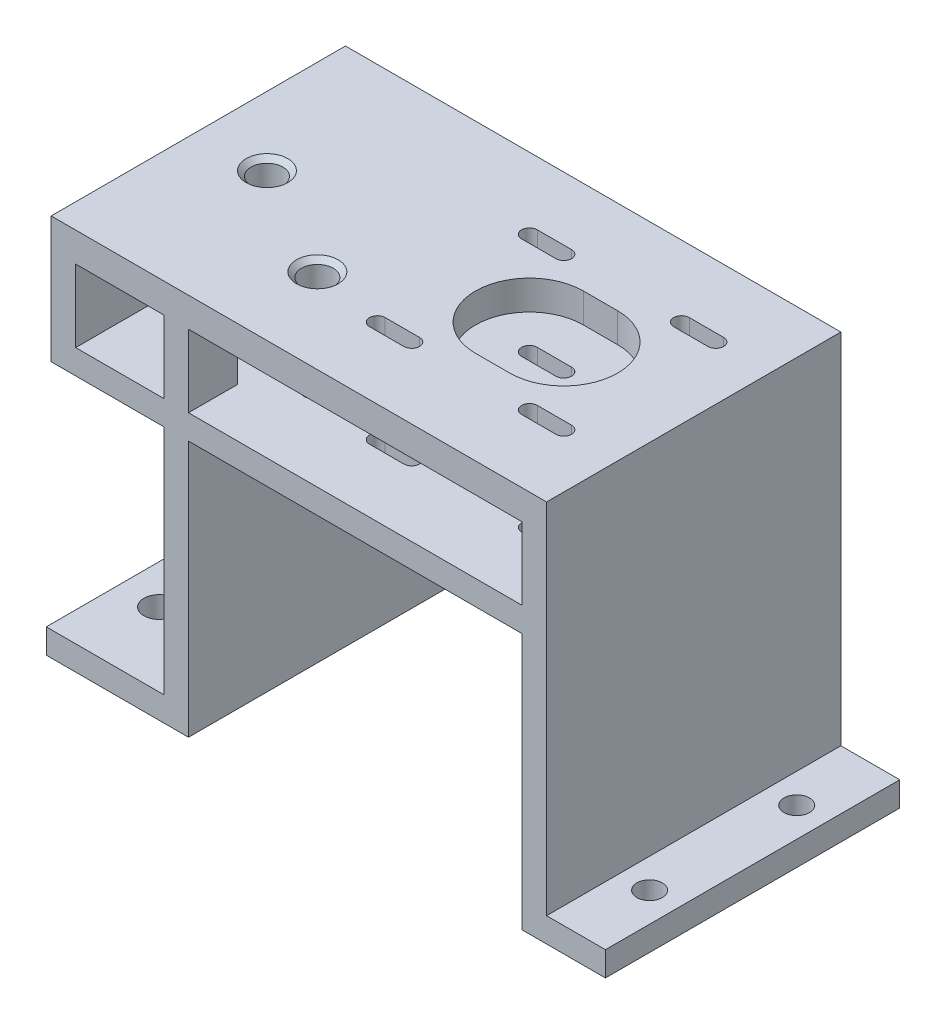
from build123d import *

# Parameters (mm, degrees)
SKETCH1_W           = 68
SKETCH1_H           = 14.75
SKETCH1_W_2         = 18
BOSS_EXTRUDE1_DEPTH = 60
CUT_EXTRUDE1_REACH  = 132.065
SKETCH2_W           = 40
SKETCH2_H           = 14.75
CUT_EXTRUDE2_DEPTH  = 131.064608945
CUT_EXTRUDE3_REACH  = 132.065
SKETCH5_R           = 3.25
CUT_EXTRUDE4_REACH  = 120.778
SKETCH6_R           = 2.6
SKETCH7_R           = 2.6
CUT_EXTRUDE5_DEPTH  = 131.064608945
CUT_EXTRUDE6_REACH  = 132.065
SKETCH8_R           = 3.25
CHAMFER1_SIZE       = 1
CUT_EXTRUDE8_REACH  = 132.065
SKETCH10_R          = 3.1
SKETCH10_R_2        = 2.6
SKETCH11_W          = 18.5
SKETCH11_H          = 16
BOSS_EXTRUDE2_DEPTH = 12
SKETCH12_R          = 3.25
CUT_EXTRUDE9_DEPTH  = 119.802577834
CHAMFER2_SIZE       = 1


with BuildPart() as part:
    # Sketch1 → Boss-Extrude1 (new body)
    with BuildSketch(Plane.XY):
        Polygon((0, 0), (-29, 0), (-29, 5), (-5, 5), (-5, 52.3), (-28, 52.3), (-28, 78.05), (73, 78.05), (73, 5), (85, 5), (85, 0), (68, 0), (68, 52.3), (0, 52.3), align=None)
        with Locations((34, 64.675)):
            Rectangle(SKETCH1_W, SKETCH1_H, mode=Mode.SUBTRACT)
        with Locations((-14, 64.675)):
            Rectangle(SKETCH1_W_2, SKETCH1_H, mode=Mode.SUBTRACT)
    extrude(amount=BOSS_EXTRUDE1_DEPTH)

    # Sketch2 → Cut-Extrude1 (cut, up to next)
    with BuildSketch(Plane(origin=(0, 0, 0), x_dir=(0, 0, -1), z_dir=(1, 0, 0)), mode=Mode.PRIVATE) as cut_extrude1_sk1:
        with Locations((-30, 64.675)):
            Rectangle(SKETCH2_W, SKETCH2_H)
    cut_extrude1_tool1 = extrude(cut_extrude1_sk1.sketch, amount=-CUT_EXTRUDE1_REACH, mode=Mode.PRIVATE) & part.part
    add(cut_extrude1_tool1.solids().sort_by_distance((0, 64.675, 30))[0], mode=Mode.SUBTRACT)

    # Sketch3 → Cut-Extrude2 (cut, through all)
    with BuildSketch(Plane(origin=(0, 78.05, 0), x_dir=(1, 0, 0), z_dir=(0, 1, 0))):
        with BuildLine():
            Line((39.5, -19), (46.5, -19))
            ThreePointArc((46.5, -19), (57.5, -30), (46.5, -41))
            Line((46.5, -41), (39.5, -41))
            ThreePointArc((39.5, -41), (28.5, -30), (39.5, -19))
        make_face()
        with BuildLine():
            Line((31, -16.1), (24, -16.1))
            ThreePointArc((24, -16.1), (22.4, -14.5), (24, -12.9))
            Line((24, -12.9), (31, -12.9))
            ThreePointArc((31, -12.9), (32.6, -14.5), (31, -16.1))
        make_face()
        with BuildLine():
            Line((55, -16.1), (62, -16.1))
            ThreePointArc((62, -16.1), (63.6, -14.5), (62, -12.9))
            Line((62, -12.9), (55, -12.9))
            ThreePointArc((55, -12.9), (53.4, -14.5), (55, -16.1))
        make_face()
        with BuildLine():
            Line((31, -43.9), (24, -43.9))
            ThreePointArc((24, -43.9), (22.4, -45.5), (24, -47.1))
            Line((24, -47.1), (31, -47.1))
            ThreePointArc((31, -47.1), (32.6, -45.5), (31, -43.9))
        make_face()
        with BuildLine():
            Line((55, -43.9), (62, -43.9))
            ThreePointArc((62, -43.9), (63.6, -45.5), (62, -47.1))
            Line((62, -47.1), (55, -47.1))
            ThreePointArc((55, -47.1), (53.4, -45.5), (55, -43.9))
        make_face()
    extrude(amount=-CUT_EXTRUDE2_DEPTH, mode=Mode.SUBTRACT)

    # Sketch5 → Cut-Extrude3 (cut, up to next)
    with BuildSketch(Plane(origin=(0, 78.05, 0), x_dir=(1, 0, 0), z_dir=(0, 1, 0)), mode=Mode.PRIVATE) as cut_extrude3_sk1:
        with Locations(Location((9, -42.73, 0), (0, 0, 270))):
            Circle(SKETCH5_R)
    cut_extrude3_tool1 = extrude(cut_extrude3_sk1.sketch, amount=-CUT_EXTRUDE3_REACH, mode=Mode.PRIVATE) & part.part
    add(cut_extrude3_tool1.solids().sort_by_distance((9, 78.05, 42.73))[0], mode=Mode.SUBTRACT)

    # Sketch6 → Cut-Extrude4 (cut, up to next)
    with BuildSketch(Plane(origin=(0, 57.3, 0), x_dir=(1, 0, 0), z_dir=(0, 1, 0)), mode=Mode.PRIVATE) as cut_extrude4_sk1:
        with Locations(Location((9, -42.73, 0), (0, 0, 270))):
            Circle(SKETCH6_R)
    cut_extrude4_tool1 = extrude(cut_extrude4_sk1.sketch, amount=-CUT_EXTRUDE4_REACH, mode=Mode.PRIVATE) & part.part
    add(cut_extrude4_tool1.solids().sort_by_distance((9, 57.3, 42.73))[0], mode=Mode.SUBTRACT)

    # Sketch7 → Cut-Extrude5 (cut, through all)
    with BuildSketch(Plane(origin=(0, 78.05, 0), x_dir=(1, 0, 0), z_dir=(0, 1, 0))):
        with Locations(Location((-14, -30, 0), (0, 0, 270))):
            Circle(SKETCH7_R)
    extrude(amount=-CUT_EXTRUDE5_DEPTH, mode=Mode.SUBTRACT)

    # Sketch8 → Cut-Extrude6 (cut, up to next)
    with BuildSketch(Plane(origin=(0, 78.05, 0), x_dir=(1, 0, 0), z_dir=(0, 1, 0)), mode=Mode.PRIVATE) as cut_extrude6_sk1:
        with Locations(Location((-14, -30, 0), (0, 0, 270))):
            Circle(SKETCH8_R)
    cut_extrude6_tool1 = extrude(cut_extrude6_sk1.sketch, amount=-CUT_EXTRUDE6_REACH, mode=Mode.PRIVATE) & part.part
    add(cut_extrude6_tool1.solids().sort_by_distance((-14, 78.05, 30))[0], mode=Mode.SUBTRACT)

    # Chamfer1
    chamfer1_edges = [part.edges().sort_by_distance(p)[0] for p in [
        (9, 78.05, 39.48),
        (-14, 78.05, 26.75),
    ]]
    chamfer(chamfer1_edges, length=CHAMFER1_SIZE)

    # Sketch10 → Cut-Extrude8 (cut, up to next)
    with BuildSketch(Plane.XZ, mode=Mode.PRIVATE) as cut_extrude8_sk1:
        with Locations((-21, 45)):
            Circle(SKETCH10_R)
    cut_extrude8_tool1 = extrude(cut_extrude8_sk1.sketch, amount=-CUT_EXTRUDE8_REACH, mode=Mode.PRIVATE) & part.part
    # Sketch10 → Cut-Extrude8 (cut, up to next)
    with BuildSketch(Plane.XZ, mode=Mode.PRIVATE) as cut_extrude8_sk2:
        with Locations((-21, 15)):
            Circle(SKETCH10_R)
    cut_extrude8_tool2 = extrude(cut_extrude8_sk2.sketch, amount=-CUT_EXTRUDE8_REACH, mode=Mode.PRIVATE) & part.part
    # Sketch10 → Cut-Extrude8 (cut, up to next)
    with BuildSketch(Plane.XZ, mode=Mode.PRIVATE) as cut_extrude8_sk3:
        with Locations((79, 15)):
            Circle(SKETCH10_R_2)
    cut_extrude8_tool3 = extrude(cut_extrude8_sk3.sketch, amount=-CUT_EXTRUDE8_REACH, mode=Mode.PRIVATE) & part.part
    # Sketch10 → Cut-Extrude8 (cut, up to next)
    with BuildSketch(Plane.XZ, mode=Mode.PRIVATE) as cut_extrude8_sk4:
        with Locations((79, 45)):
            Circle(SKETCH10_R_2)
    cut_extrude8_tool4 = extrude(cut_extrude8_sk4.sketch, amount=-CUT_EXTRUDE8_REACH, mode=Mode.PRIVATE) & part.part
    add(cut_extrude8_tool1.solids().sort_by_distance((-21, 0, 45))[0], mode=Mode.SUBTRACT)
    add(cut_extrude8_tool2.solids().sort_by_distance((-21, 0, 15))[0], mode=Mode.SUBTRACT)
    add(cut_extrude8_tool3.solids().sort_by_distance((79, 0, 15))[0], mode=Mode.SUBTRACT)
    add(cut_extrude8_tool4.solids().sort_by_distance((79, 0, 45))[0], mode=Mode.SUBTRACT)

    # Sketch11 → Boss-Extrude2 (add)
    with BuildSketch(Plane.XZ.offset(-52.3)):
        with Locations((9.25, 30)):
            Rectangle(SKETCH11_W, SKETCH11_H)
    extrude(amount=BOSS_EXTRUDE2_DEPTH)

    # Sketch12 → Cut-Extrude9 (cut, through all)
    with BuildSketch(Plane(origin=(18.5, 0, 0), x_dir=(0, 0, -1), z_dir=(1, 0, 0))):
        with Locations((-29.45403853, 46.709471103)):
            Circle(SKETCH12_R)
    extrude(amount=-CUT_EXTRUDE9_DEPTH, mode=Mode.SUBTRACT)

    # Chamfer2
    chamfer2_edges = [part.edges().sort_by_distance(p)[0] for p in [
        (-5, 46.709471103, 32.70403853),
    ]]
    chamfer(chamfer2_edges, length=CHAMFER2_SIZE)


solid = part.part
